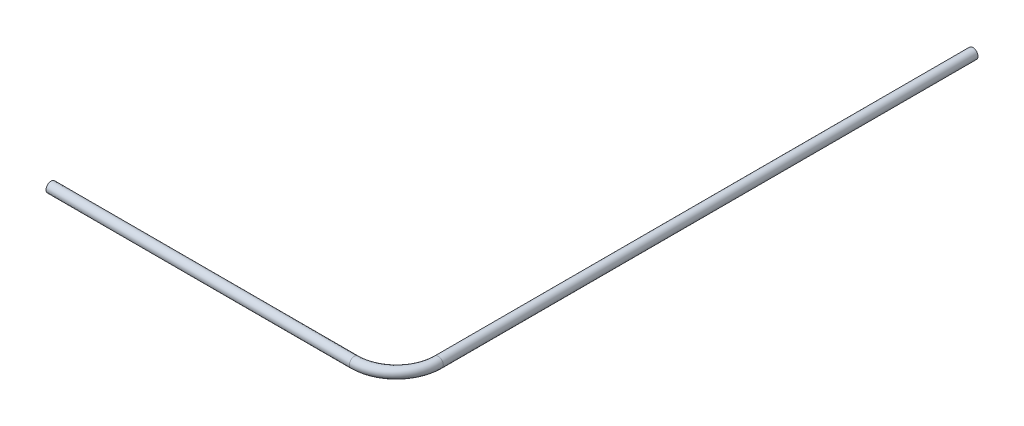
from build123d import *

# Parameters (mm, degrees)
SKETCH_2_R = 6


with BuildPart() as part:
    # По траектории1: sweep along a path in Эскиз1
    with BuildLine(Plane(origin=(0, 0, 0), x_dir=(1, 0, 0), z_dir=(0, 1, 0))) as sweep_1_path:
        Line((12, 250), (12, -388))
        ThreePointArc((12, -388), (-2.644660941, -423.355339059), (-38, -438))
        Line((-38, -438), (-400, -438))
    # Эскиз2 → По траектории1 (sweep)
    with BuildSketch(Plane(origin=(150, -150, 0), x_dir=(1, 0, 0), z_dir=(0, 0, 1))):
        with Locations((-138, 150)):
            Circle(SKETCH_2_R)
    sweep(path=sweep_1_path.line)


solid = part.part
